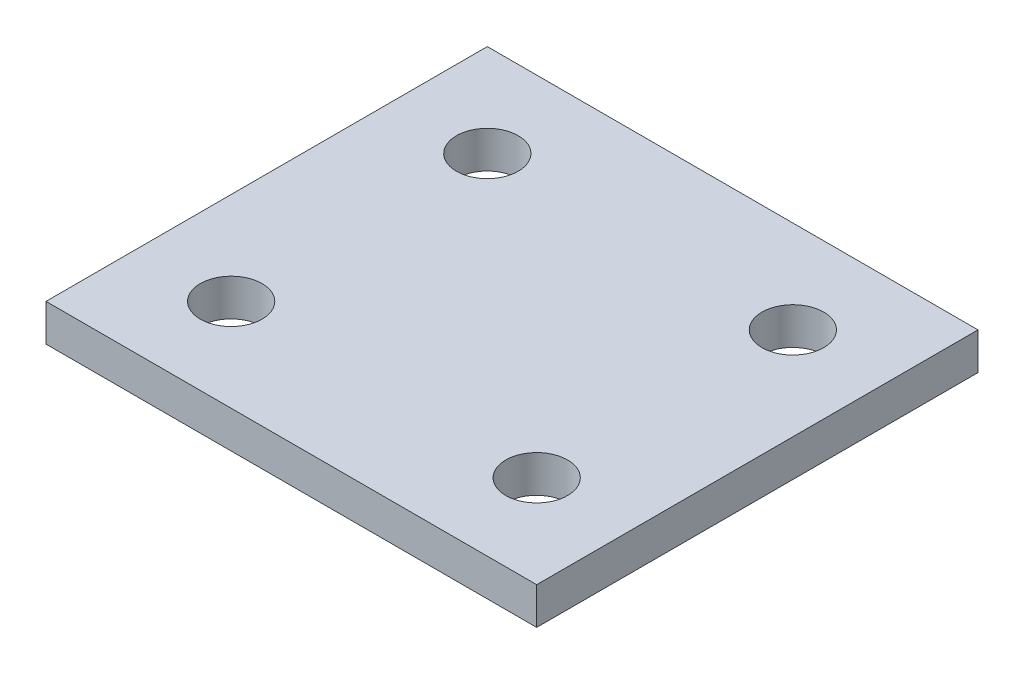
from build123d import *

# Parameters (mm, degrees)
ESQUISSE3_W        = 15.9
ESQUISSE3_H        = 14.3
ESQUISSE3_R        = 1
BOSS_EXTRU_1_DEPTH = 1.2


with BuildPart() as part:
    # Esquisse3 → Boss.-Extru.1 (new body)
    with BuildSketch(Plane(origin=(0, 0, 0), x_dir=(1, 0, 0), z_dir=(0, 1, 0))):
        with Locations((7.95, -7.15)):
            Rectangle(ESQUISSE3_W, ESQUISSE3_H)
        with Locations(Location((3, -3, 0), (0, 0, 270))):
            Circle(ESQUISSE3_R, mode=Mode.SUBTRACT)
        with Locations(Location((12.9, -3, 0), (0, 0, 270))):
            Circle(ESQUISSE3_R, mode=Mode.SUBTRACT)
        with Locations(Location((12.9, -11.3, 0), (0, 0, 270))):
            Circle(ESQUISSE3_R, mode=Mode.SUBTRACT)
        with Locations(Location((3, -11.3, 0), (0, 0, 270))):
            Circle(ESQUISSE3_R, mode=Mode.SUBTRACT)
    extrude(amount=BOSS_EXTRU_1_DEPTH)


solid = part.part
